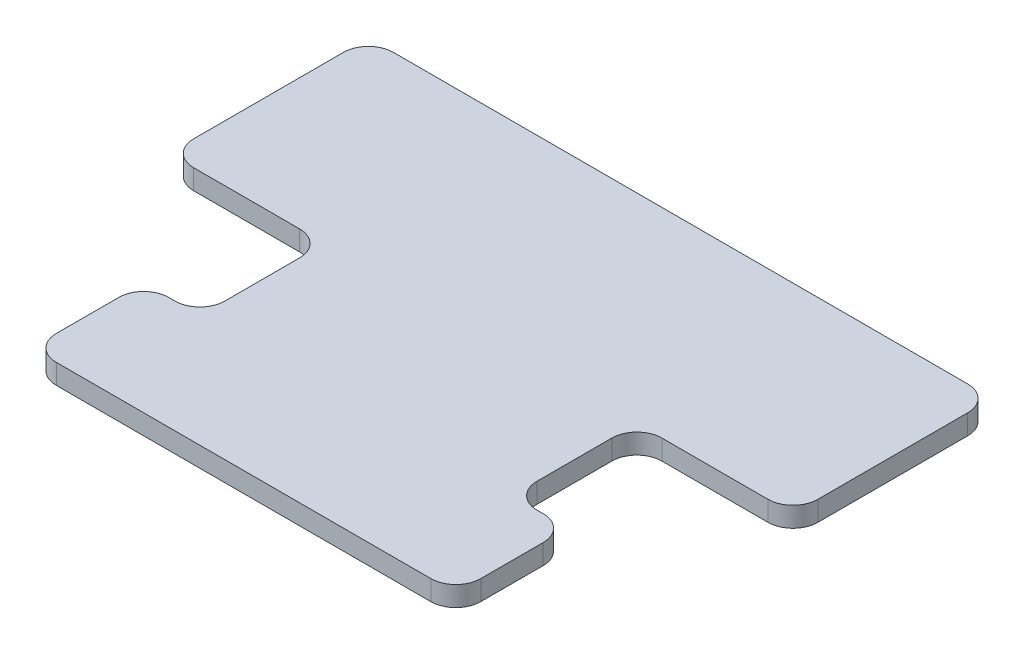
from build123d import *

# Parameters (mm, degrees)
EXTRUDE_2_DEPTH = 1.6


with BuildPart() as part:
    # 스케치1 → 보스-돌출2 (new body)
    with BuildSketch(Plane(origin=(0, 0, 0), x_dir=(1, 0, 0), z_dir=(0, 1, 0))):
        with BuildLine():
            Line((14.5, -0.026494673), (23, -0.026494673))
            ThreePointArc((23, -0.026494673), (24.414213562, 0.559291765), (25, 1.973505327))
            Line((25, 1.973505327), (25, 13.973505327))
            ThreePointArc((25, 13.973505327), (24.414213562, 15.38771889), (23, 15.973505327))
            Line((23, 15.973505327), (-23, 15.973505327))
            ThreePointArc((-23, 15.973505327), (-24.414213562, 15.38771889), (-25, 13.973505327))
            Line((-25, 13.973505327), (-25, 1.973505327))
            ThreePointArc((-25, 1.973505327), (-24.414213562, 0.559291765), (-23, -0.026494673))
            Line((-23, -0.026494673), (-14.5, -0.026494673))
            ThreePointArc((-14.5, -0.026494673), (-13.085786438, -0.61228111), (-12.5, -2.026494673))
            Line((-12.5, -2.026494673), (-12.5, -8.026494673))
            ThreePointArc((-12.5, -8.026494673), (-13.085786438, -9.440708235), (-14.5, -10.026494673))
            Line((-14.5, -10.026494673), (-15, -10.026494673))
            ThreePointArc((-15, -10.026494673), (-16.414213562, -10.61228111), (-17, -12.026494673))
            Line((-17, -12.026494673), (-17, -17.026494673))
            ThreePointArc((-17, -17.026494673), (-16.414213562, -18.440708235), (-15, -19.026494673))
            Line((-15, -19.026494673), (15, -19.026494673))
            ThreePointArc((15, -19.026494673), (16.414213562, -18.440708235), (17, -17.026494673))
            Line((17, -17.026494673), (17, -12.026494673))
            ThreePointArc((17, -12.026494673), (16.414213562, -10.61228111), (15, -10.026494673))
            Line((15, -10.026494673), (14.5, -10.026494673))
            ThreePointArc((14.5, -10.026494673), (13.085786438, -9.440708235), (12.5, -8.026494673))
            Line((12.5, -8.026494673), (12.5, -2.026494673))
            ThreePointArc((12.5, -2.026494673), (13.085786438, -0.61228111), (14.5, -0.026494673))
        make_face()
    extrude(amount=EXTRUDE_2_DEPTH)


solid = part.part
